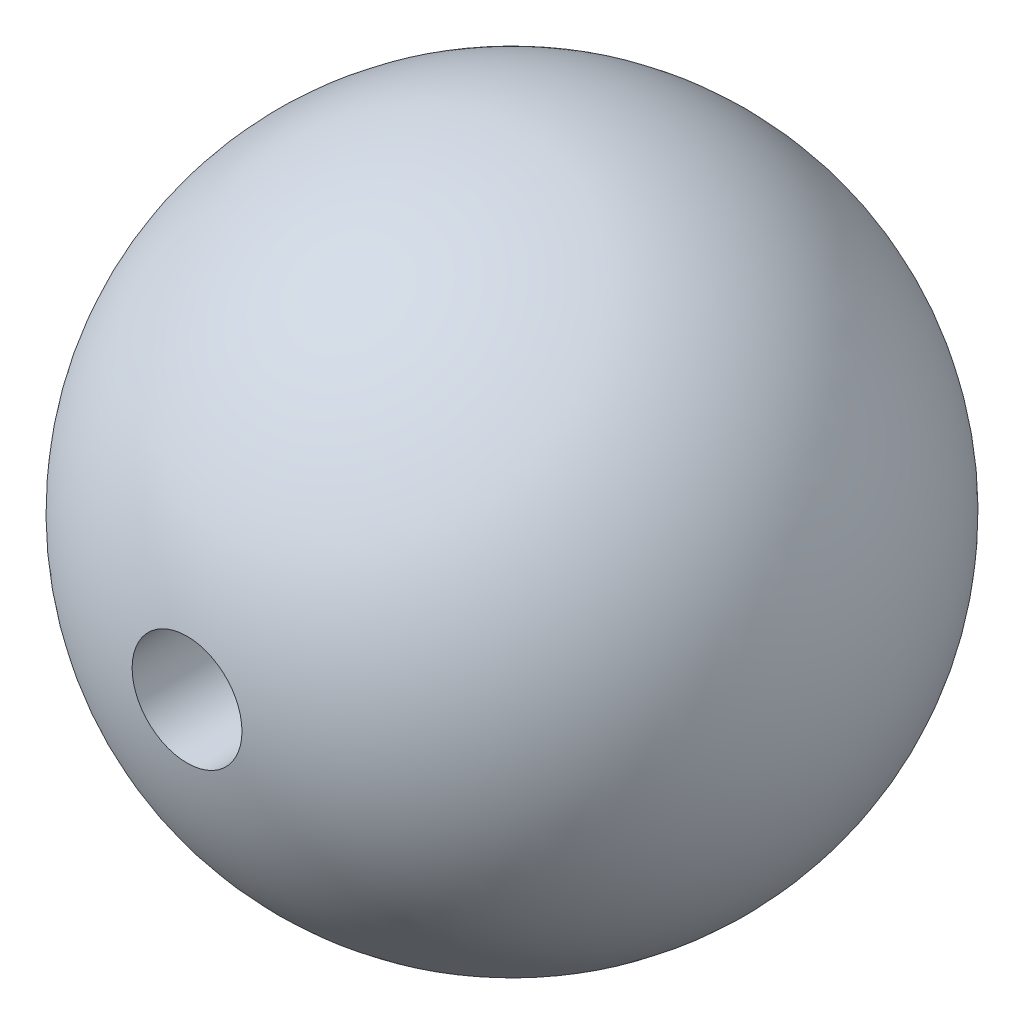
from build123d import *

# Parameters (mm, degrees)
CORTAR_EXTRUIR1_DEPTH      = 17.497783942
CORTAR_EXTRUIR1_DEPTH_BACK = 17.497783942
CROQUIS2_R                 = 1.5875


with BuildPart() as part:
    # Croquis1 → Revolución1 (revolve)
    with BuildSketch(Plane.XY):
        with BuildLine():
            Line((0, 3.175), (3.9624, 3.175))
            Line((3.9624, 3.175), (3.9624, -8.661697942))
            ThreePointArc((3.9624, -8.661697942), (9.306672281, 2.027677502), (0, 9.525))
            Line((0, 9.525), (0, 3.175))
        make_face()
    revolve(axis=Axis((0, 3.175, 0), (0, 1, 0)))

    # Croquis2 → Cortar-Extruir1 (cut, two sides: drawn at the far end of the back side and taken through both)
    with BuildSketch(Plane.XY.offset(-CORTAR_EXTRUIR1_DEPTH_BACK)):
        Circle(CROQUIS2_R)
    extrude(amount=CORTAR_EXTRUIR1_DEPTH + CORTAR_EXTRUIR1_DEPTH_BACK, mode=Mode.SUBTRACT)


solid = part.part
